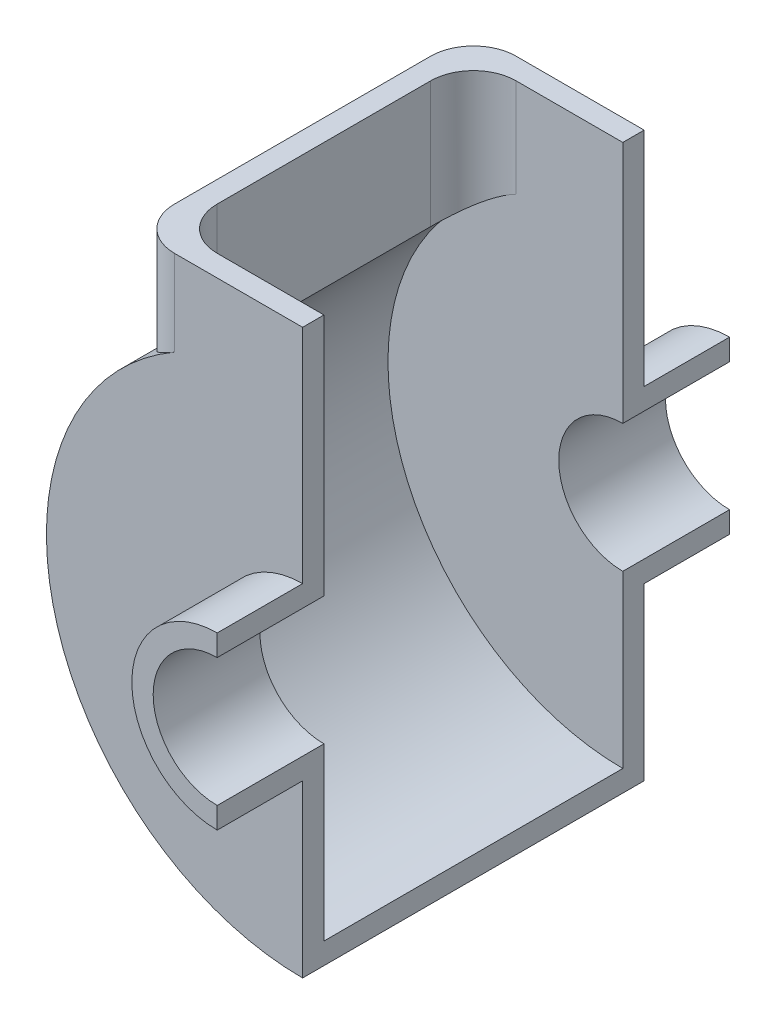
from build123d import *

# Parameters (mm, degrees)
DODANIE_WYCI_GNI_CIE1_DEPTH       = 25
DODANIE_WYCI_GNI_CIE2_DEPTH       = 5
WYCI_GNI_CIE_CIENKA_CIANKA7_DEPTH = 70
ZAOKR_GLENIE1_R                   = 10


with BuildPart() as part:
    # Szkic1 → Dodanie-wyciągnięcie1 (new body)
    with BuildSketch(Plane.XY):
        with BuildLine():
            Line((0, -15), (0, -20))
            ThreePointArc((0, -20), (-20, 0), (0, 20))
            Line((0, 20), (0, 15))
            ThreePointArc((0, 15), (-15, 0), (0, -15))
        make_face()
    extrude(amount=DODANIE_WYCI_GNI_CIE1_DEPTH)

    # Szkic2 → Dodanie-wyciągnięcie2 (add)
    with BuildSketch(Plane.XY):
        with BuildLine():
            Line((0, 20), (0, 72))
            Line((0, 72), (-40, 72))
            Line((-40, 72), (-40, 44.72135955))
            ThreePointArc((-40, 44.72135955), (-56.050341538, -21.409325386), (0, -60))
            Line((0, -60), (0, -20))
            ThreePointArc((0, -20), (-20, 0), (0, 20))
        make_face()
    extrude(amount=DODANIE_WYCI_GNI_CIE2_DEPTH)


with BuildPart() as body_2:
    # Lustro2: mirrored copy
    add(part.part.mirror(Plane.XY.offset(-35)))


with BuildPart() as part_1:
    add(part.part)

    add(body_2.part)  # Wyciągnięcie-cienka ścianka7 merges body 2
    # Szkic3 → Wyciągnięcie-cienka ścianka7 (add)
    with BuildSketch(Plane(origin=(0, 0, 0), x_dir=(-1, 0, 0), z_dir=(0, 0, -1))):
        with BuildLine():
            Line((40, 72), (40, 44.72135955))
            ThreePointArc((40, 44.72135955), (56.050341538, -21.409325386), (0, -60))
            Line((0, -60), (0, -55))
            ThreePointArc((0, -55), (51.76124215, -18.594994247), (35, 42.426406871))
            Line((35, 42.426406871), (35, 72))
            Line((35, 72), (40, 72))
        make_face()
    extrude(amount=WYCI_GNI_CIE_CIENKA_CIANKA7_DEPTH)

    # Zaokrąglenie1
    zaokr_glenie1_edges = [part_1.edges().sort_by_distance(p)[0] for p in [
        (-40, 58.360679775, 5),
        (-35, 57.213203436, -70),
        (-35, 57.213203436, 0),
        (-40, 58.360679775, -75),
    ]]
    fillet(zaokr_glenie1_edges, radius=ZAOKR_GLENIE1_R)


solid = part_1.part
